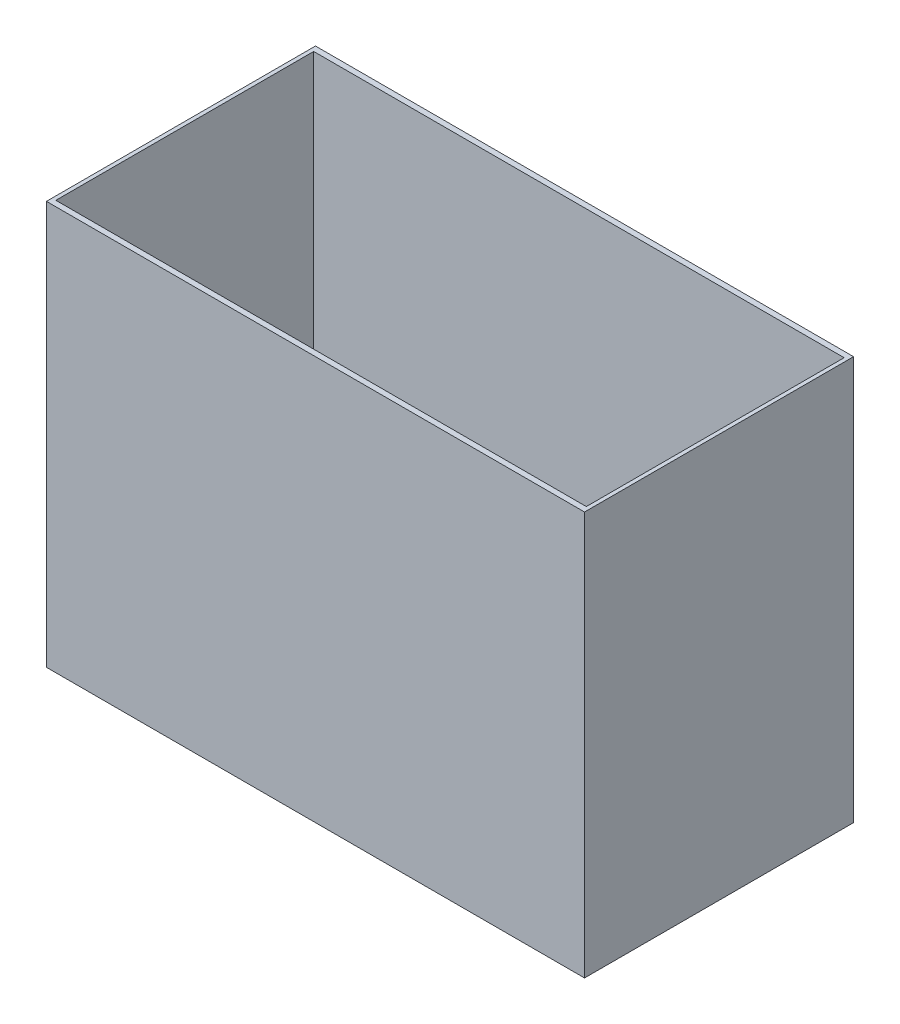
from build123d import *

# Parameters (mm, degrees)
SKETCH1_W           = 584.2
SKETCH1_H           = 279.4
BOSS_EXTRUDE1_DEPTH = 12.7
SKETCH3_W           = 609.6
SKETCH3_H           = 304.8
SKETCH3_W_2         = 600.964
SKETCH3_H_2         = 292.1
BOSS_EXTRUDE3_DEPTH = 457.2
SKETCH4_R           = 2.778125
CUT_EXTRUDE1_DEPTH  = 561.097357608
SKETCH6_R           = 6.35
CUT_EXTRUDE2_DEPTH  = 2.54
SKETCH7_R           = 2.778125
CUT_EXTRUDE3_DEPTH  = 561.097357608


with BuildPart() as part:
    # Sketch1 → Boss-Extrude1 (new body)
    with BuildSketch(Plane(origin=(0, 0, 0), x_dir=(1, 0, 0), z_dir=(0, 1, 0))):
        Rectangle(SKETCH1_W, SKETCH1_H)
    extrude(amount=BOSS_EXTRUDE1_DEPTH)

    # Sketch4 → Cut-Extrude1 (cut, through all)
    with BuildSketch(Plane(origin=(0, 12.7, 0), x_dir=(1, 0, 0), z_dir=(0, 1, 0))):
        with Locations(Location((254, 101.6, 0), (0, 0, 270))):
            Circle(SKETCH4_R)
    cut_extrude1 = extrude(amount=-CUT_EXTRUDE1_DEPTH, mode=Mode.SUBTRACT)

    # Sketch6 → Cut-Extrude2 (cut)
    with BuildSketch(Plane.XZ):
        with Locations(Location((254, -101.6, 0), (0, 0, 270))):
            Circle(SKETCH6_R)
    cut_extrude2 = extrude(amount=-CUT_EXTRUDE2_DEPTH, mode=Mode.SUBTRACT)

    # Mirror1: Cut-Extrude1, Cut-Extrude2 across plane
    add(cut_extrude1.mirror(Plane.XY), mode=Mode.SUBTRACT)
    add(cut_extrude2.mirror(Plane.XY), mode=Mode.SUBTRACT)

    # Sketch7 → Cut-Extrude3 (cut, through all)
    with BuildSketch(Plane(origin=(0, 12.7, 0), x_dir=(1, 0, 0), z_dir=(0, 1, 0))):
        with Locations(Location((190.5, 0, 0), (0, 0, 270))):
            Circle(SKETCH7_R)
    extrude(amount=-CUT_EXTRUDE3_DEPTH, mode=Mode.SUBTRACT)


with BuildPart() as body_2:
    # Sketch3 → Boss-Extrude3 (new body)
    with BuildSketch(Plane(origin=(0, 0, 0), x_dir=(1, 0, 0), z_dir=(0, 1, 0))):
        Rectangle(SKETCH3_W, SKETCH3_H)
        Rectangle(SKETCH3_W_2, SKETCH3_H_2, mode=Mode.SUBTRACT)
    extrude(amount=BOSS_EXTRUDE3_DEPTH)


solid = Compound([part.part, body_2.part])
